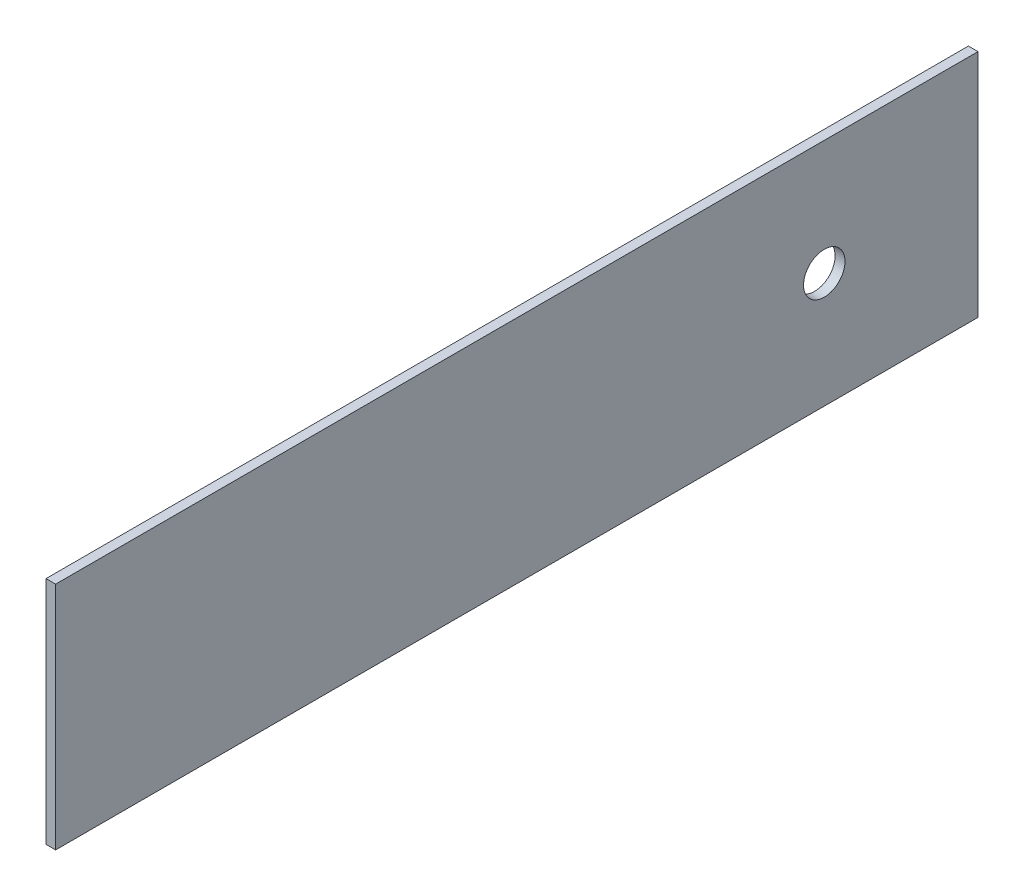
from build123d import *

# Parameters (mm, degrees)
SKETCH1_W           = 304.8
SKETCH1_H           = 76.073
BOSS_EXTRUDE1_DEPTH = 3.175


with BuildPart() as part:
    # Sketch1 → Boss-Extrude1 (new body)
    with BuildSketch(Plane(origin=(0, 0, 0), x_dir=(0, 0, -1), z_dir=(1, 0, 0))):
        with Locations((152.4, -38.0365)):
            Rectangle(SKETCH1_W, SKETCH1_H)
    extrude(amount=BOSS_EXTRUDE1_DEPTH)

    # Sketch7 → 1/4 NPT Tapped Hole2 (revolve, cut)
    with BuildSketch(Plane(origin=(3.175, -38.0365, -254), x_dir=(0, 0, -1), z_dir=(0, 1, 0))):
        Polygon((0, 0), (0, 3.175), (5.5626, 3.175), (5.5626, 9.906), (6.557984794, 9.906), (6.8545837, 0), align=None)
    revolve(axis=Axis((9.525, -38.0365, -254), (-1, 0, 0)), mode=Mode.SUBTRACT)


solid = part.part
